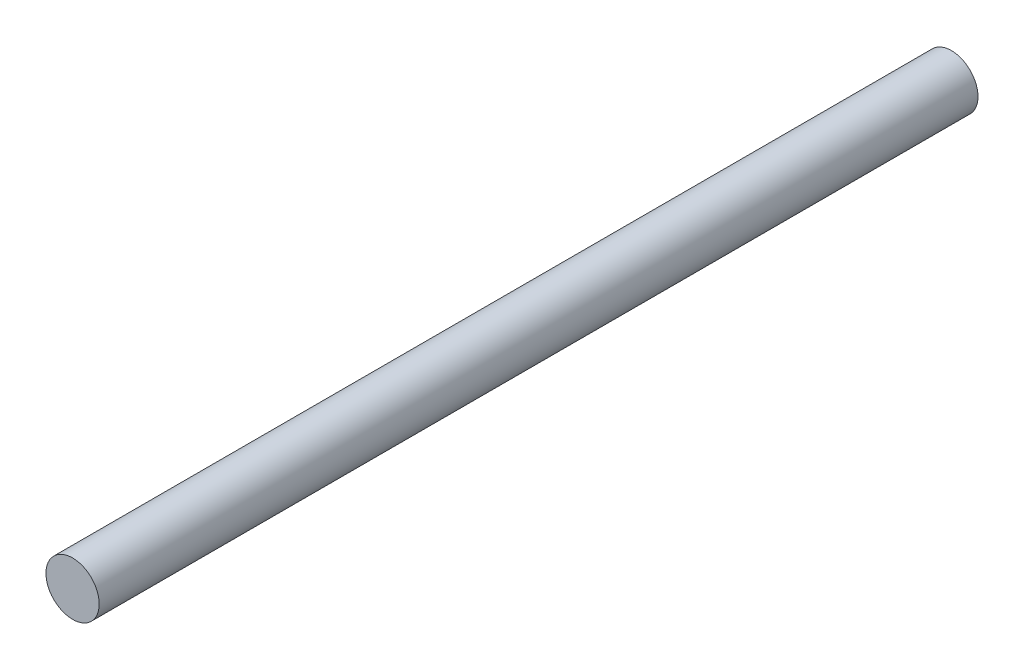
from build123d import *

# Parameters (mm, degrees)
SKETCH1_R           = 1
BOSS_EXTRUDE1_DEPTH = 33


with BuildPart() as part:
    # Sketch1 → Boss-Extrude1 (new body)
    with BuildSketch(Plane.XY):
        Circle(SKETCH1_R)
    extrude(amount=BOSS_EXTRUDE1_DEPTH)


solid = part.part
